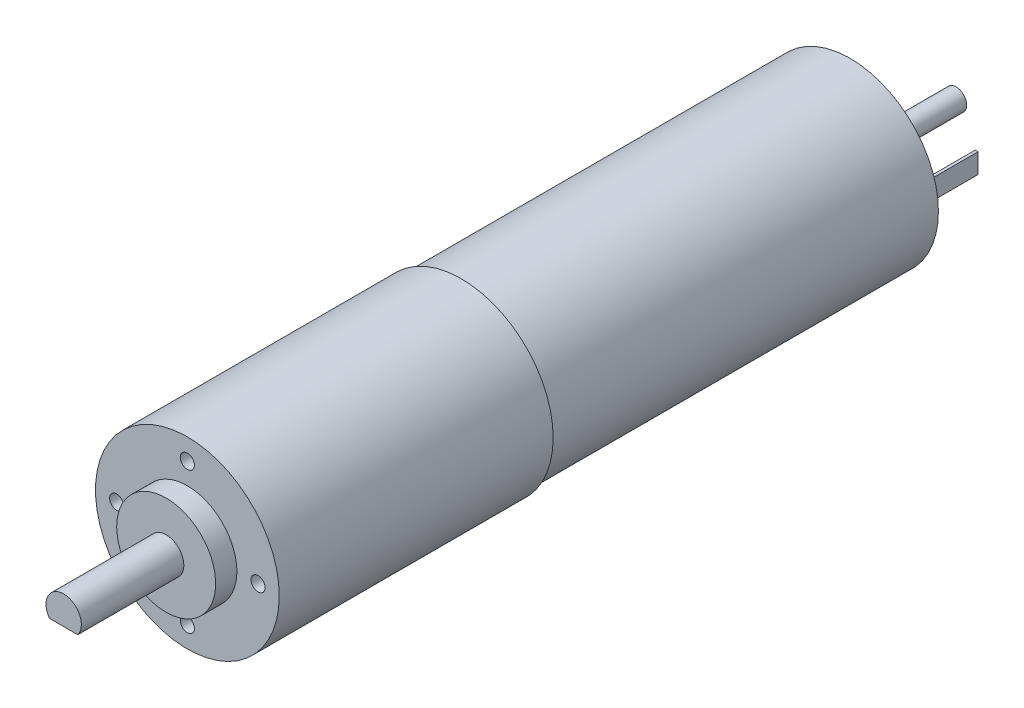
from build123d import *

# Parameters (mm, degrees)
SKETCH1_R          = 12.5
EXTRUSION1_DEPTH   = 55
SKETCH2_R          = 13
EXTRUSION2_DEPTH   = 38.75
SKETCH3_R          = 7
EXTRUSION3_DEPTH   = 3
SKETCH4_R          = 2.5
EXTRUSION4_DEPTH   = 14.5
SKETCH5_R          = 1
EXTRUSION5_DEPTH   = 4
SKETCH6_R          = 4
EXTRUSION6_DEPTH   = 2.75
SKETCH7_R          = 1.5
EXTRUSION7_DEPTH   = 15
SKETCH8_W          = 0.4
SKETCH8_H          = 2.8
EXTRUSION8_DEPTH   = 8.7
CUT_EXTRUDE1_DEPTH = 10


with BuildPart() as part:
    # Sketch1 → Extrusion1 (new body)
    with BuildSketch(Plane.XY):
        Circle(SKETCH1_R)
    extrude(amount=EXTRUSION1_DEPTH)

    # Sketch2 → Extrusion2 (add)
    with BuildSketch(Plane.XY.offset(55)):
        Circle(SKETCH2_R)
    extrude(amount=EXTRUSION2_DEPTH)

    # Sketch3 → Extrusion3 (add)
    with BuildSketch(Plane.XY.offset(93.75)):
        with Locations(Location((0, 0, 0), (0, 0, 180))):
            Circle(SKETCH3_R)
    extrude(amount=EXTRUSION3_DEPTH)

    # Sketch4 → Extrusion4 (add)
    with BuildSketch(Plane.XY.offset(96.75)):
        Circle(SKETCH4_R)
    extrude(amount=EXTRUSION4_DEPTH)

    # Sketch5 → Extrusion5 (cut)
    with BuildSketch(Plane.XY.offset(93.75)):
        with Locations((0, 10)):
            Circle(SKETCH5_R)
        with Locations((10, 0)):
            Circle(SKETCH5_R)
        with Locations((0, -10)):
            Circle(SKETCH5_R)
        with Locations((-10, 0)):
            Circle(SKETCH5_R)
    extrude(amount=-EXTRUSION5_DEPTH, mode=Mode.SUBTRACT)

    # Sketch6 → Extrusion6 (add)
    with BuildSketch(Plane(origin=(0, 0, 0), x_dir=(-1, 0, 0), z_dir=(0, 0, -1))):
        Circle(SKETCH6_R)
    extrude(amount=EXTRUSION6_DEPTH)

    # Sketch7 → Extrusion7 (add)
    with BuildSketch(Plane(origin=(0, 0, 0), x_dir=(-1, 0, 0), z_dir=(0, 0, -1))):
        Circle(SKETCH7_R)
    extrude(amount=EXTRUSION7_DEPTH)

    # Sketch8 → Extrusion8 (add)
    with BuildSketch(Plane(origin=(0, 0, 0), x_dir=(-1, 0, 0), z_dir=(0, 0, -1))):
        with Locations((9.2, 0)):
            Rectangle(SKETCH8_W, SKETCH8_H)
        with Locations((-9.2, 0)):
            Rectangle(SKETCH8_W, SKETCH8_H)
    extrude(amount=EXTRUSION8_DEPTH)

    # Sketch9 → Cut-Extrude1 (cut)
    with BuildSketch(Plane.XY.offset(111.25)):
        Polygon((53.72529209, -1.5), (2, -1.5), (-2, -1.5), (-53.72529209, -1.5), (-53.72529209, -104.95058418), (53.72529209, -104.95058418), align=None)
    extrude(amount=-CUT_EXTRUDE1_DEPTH, mode=Mode.SUBTRACT)


solid = part.part
